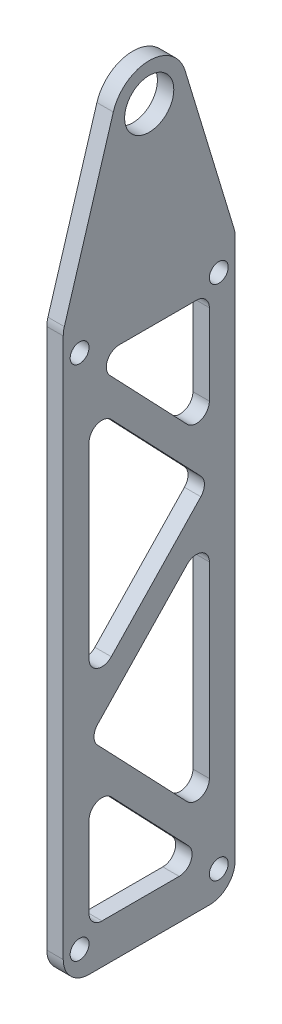
from build123d import *

# Parameters (mm, degrees)
SKETCH1_R           = 1.8288
SKETCH1_R_2         = 4.7625
BOSS_EXTRUDE1_DEPTH = 3.175
CUT_EXTRUDE1_DEPTH  = 107.506615522
FILLET1_R           = 2.5
FILLET2_R           = 5


with BuildPart() as part:
    # Sketch1 → Boss-Extrude1 (new body)
    with BuildSketch(Plane(origin=(0, 0, 0), x_dir=(0, 0, -1), z_dir=(1, 0, 0))):
        with BuildLine():
            Line((-16.645, -105.15), (16.645, -105.15))
            Line((16.645, -105.15), (16.645, 5.15))
            Line((16.645, 5.15), (6.94973031, 37.108353593))
            ThreePointArc((6.94973031, 37.108353593), (0, 42.2625), (-6.94973031, 37.108353593))
            Line((-6.94973031, 37.108353593), (-16.645, 5.15))
            Line((-16.645, 5.15), (-16.645, -105.15))
        make_face()
        with Locations((-13.4747, 0)):
            Circle(SKETCH1_R, mode=Mode.SUBTRACT)
        with Locations((0, 35)):
            Circle(SKETCH1_R_2, mode=Mode.SUBTRACT)
        with Locations((13.4747, 0)):
            Circle(SKETCH1_R, mode=Mode.SUBTRACT)
        with Locations((-13.4747, -100)):
            Circle(SKETCH1_R, mode=Mode.SUBTRACT)
        with Locations((13.4747, -100)):
            Circle(SKETCH1_R, mode=Mode.SUBTRACT)
    extrude(amount=BOSS_EXTRUDE1_DEPTH)

    # Sketch2 → Cut-Extrude1 (cut, through all)
    with BuildSketch(Plane(origin=(3.175, 0, 0), x_dir=(0, 0, -1), z_dir=(1, 0, 0))):
        Polygon((11.645, -2.5), (-11.645, -2.5), (11.645, -26.898674048), align=None)
        Polygon((-11.645, -9.741325952), (11.645, -34.14), (-11.645, -58.538674048), (-11.645, -34.14), align=None)
        Polygon((-11.645, -73.021325952), (-11.645, -97.42), (11.645, -97.42), align=None)
        Polygon((11.645, -41.381325952), (11.645, -65.78), (11.645, -90.178674048), (-11.645, -65.78), align=None)
    extrude(amount=-CUT_EXTRUDE1_DEPTH, mode=Mode.SUBTRACT)

    # Fillet1
    fillet1_edges = [part.edges().sort_by_distance(p)[0] for p in [
        (1.5875, -9.741325952, 11.645),
        (1.5875, -34.14, -11.645),
        (1.5875, -58.538674048, 11.645),
        (1.5875, -26.898674048, -11.645),
        (1.5875, -2.5, 11.645),
        (1.5875, -2.5, -11.645),
        (1.5875, -90.178674048, -11.645),
        (1.5875, -65.78, 11.645),
        (1.5875, -41.381325952, -11.645),
        (1.5875, -73.021325952, 11.645),
        (1.5875, -97.42, -11.645),
        (1.5875, -97.42, 11.645),
    ]]
    fillet(fillet1_edges, radius=FILLET1_R)

    # Fillet2
    fillet2_edges = [part.edges().sort_by_distance(p)[0] for p in [
        (1.5875, -105.15, -16.645),
        (1.5875, -105.15, 16.645),
        (1.5875, 5.15, 16.645),
        (1.5875, 5.15, -16.645),
    ]]
    fillet(fillet2_edges, radius=FILLET2_R)


solid = part.part
